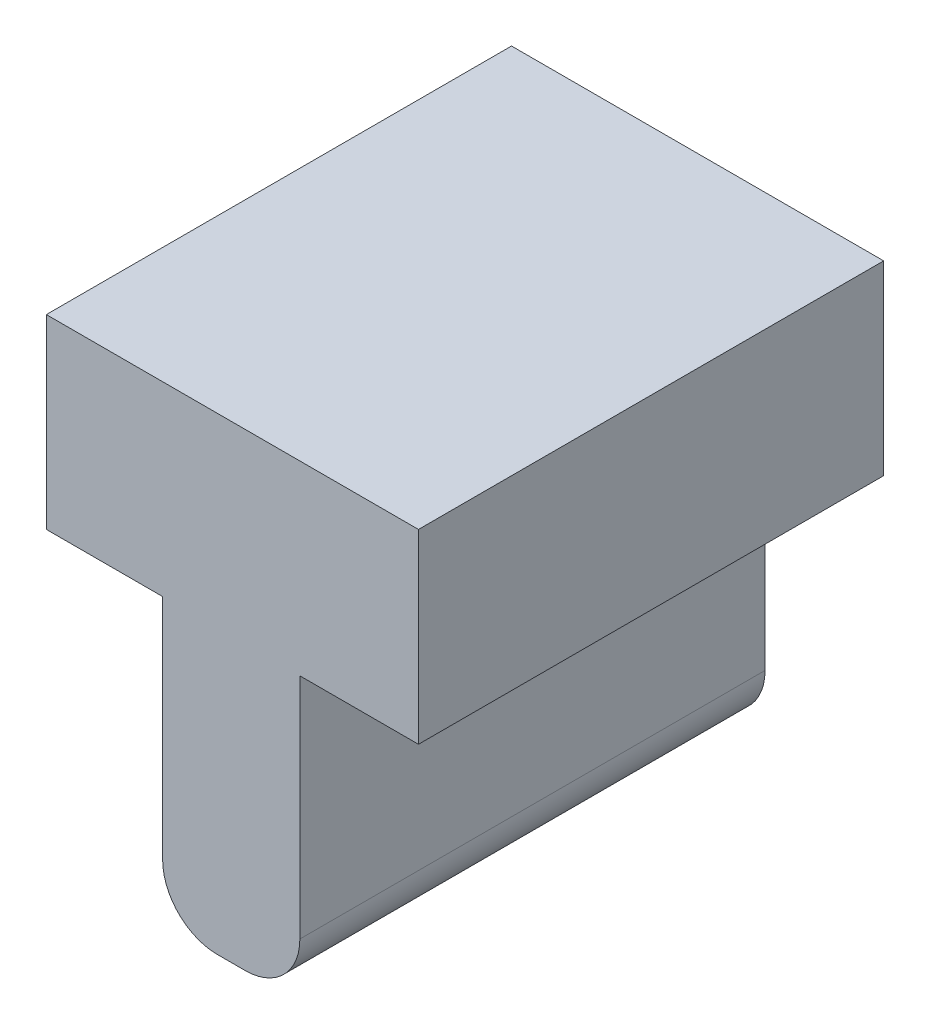
from build123d import *

# Parameters (mm, degrees)
BOSS_EXTRUDE1_DEPTH = 10


with BuildPart() as part:
    # Sketch1 → Boss-Extrude1 (new, symmetric)
    with BuildSketch(Plane.XY):
        with BuildLine():
            Line((8, 8.075), (2.9, 8.075))
            Line((2.9, 8.075), (2.9, -1.725))
            ThreePointArc((2.9, -1.725), (2.211700936, -3.386700936), (0.55, -4.075))
            Line((0.55, -4.075), (-0.65, -4.075))
            ThreePointArc((-0.65, -4.075), (-2.311700936, -3.386700936), (-3, -1.725))
            Line((-3, -1.725), (-3, 8.075))
            Line((-3, 8.075), (-8, 8.075))
            Line((-8, 8.075), (-8, 16.075))
            Line((-8, 16.075), (8, 16.075))
            Line((8, 16.075), (8, 8.075))
        make_face()
    extrude(amount=BOSS_EXTRUDE1_DEPTH, both=True)


solid = part.part
